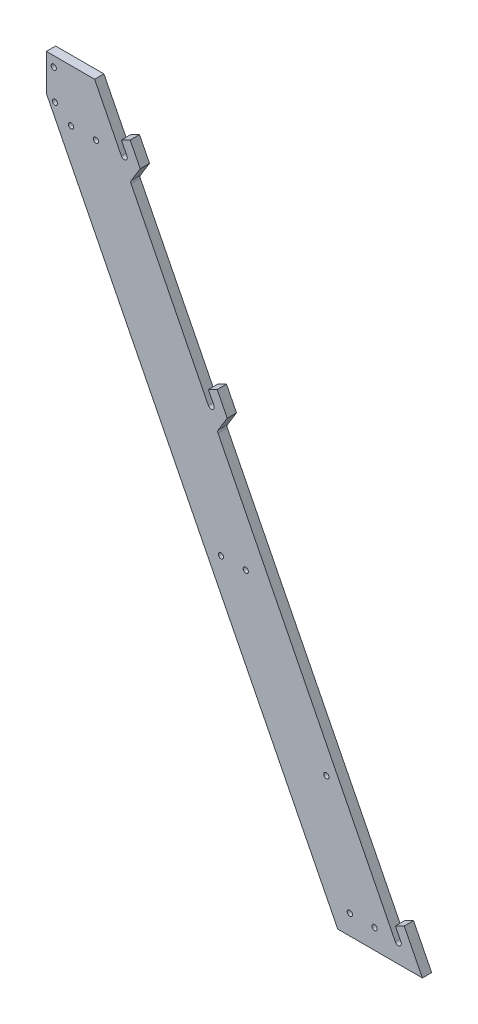
from build123d import *

# Parameters (mm, degrees)
BOSS_EXTRUDE1_DEPTH     = 5.953125
SKETCH3_W               = 47.23204247
SKETCH3_H               = 13.081
CUT_EXTRUDE1_DEPTH      = 924.398153884
BOSS_EXTRUDE3_DEPTH     = 11.90625
F_1_4_CLEARANCE_HOLE1_D = 6.7564
SKETCH13_W              = 23.41954247
SKETCH13_H              = 28.3464
CUT_EXTRUDE2_DEPTH      = 924.398153884
SKETCH14_R              = 3.429
CUT_EXTRUDE3_DEPTH      = 913.667776704
F_1_4_CLEARANCE_HOLE2_D = 6.7564
CUT_EXTRUDE4_DEPTH      = 913.667776704
BOSS_EXTRUDE4_START     = -11.90625
BOSS_EXTRUDE4_DEPTH     = 11.90625
BOSS_EXTRUDE5_DEPTH     = 11.90625
CUT_EXTRUDE5_DEPTH      = 912.387123535
FILLET1_R               = 3.3782


with BuildPart() as part:
    # Sketch1 → Boss-Extrude1 (new, symmetric)
    with BuildSketch(Plane.XY):
        Polygon((0, 0), (-396.875, 787.4), (-482.20704247, 787.4), (-85.33204247, 0), align=None)
    extrude(amount=BOSS_EXTRUDE1_DEPTH, both=True)

    # Sketch3 → Cut-Extrude1 (cut, through all)
    with BuildSketch(Plane.XY.offset(5.953125)):
        with Locations((-252.216021235, 371.4115)):
            Rectangle(SKETCH3_W, SKETCH3_H)
        with Locations((-444.303521235, 752.5131)):
            Rectangle(SKETCH3_W, SKETCH3_H)
    extrude(amount=-CUT_EXTRUDE1_DEPTH, mode=Mode.SUBTRACT)

    # Sketch10 → Boss-Extrude3 (add)
    with BuildSketch(Plane.XY.offset(5.953125)):
        with BuildLine():
            Line((-244.024703128, 501.780299783), (-249.740869802, 513.121174464))
            ThreePointArc((-249.740869802, 513.121174464), (-246.928515798, 521.649695143), (-238.39999512, 518.837341139))
            Line((-238.39999512, 518.837341139), (-226.967661771, 496.155591775))
            Line((-226.967661771, 496.155591775), (-239.680416455, 475.525946247))
            Line((-239.680416455, 475.525946247), (-251.112749804, 498.207695611))
            ThreePointArc((-251.112749804, 498.207695611), (-245.78242438, 496.449974359), (-244.024703128, 501.780299783))
        make_face()
        with BuildLine():
            Line((-351.145666605, 696.673002545), (-362.577999954, 719.354751908))
            ThreePointArc((-362.577999954, 719.354751908), (-357.24767453, 717.597030656), (-355.489953278, 722.92735608))
            Line((-355.489953278, 722.92735608), (-361.206119952, 734.268230762))
            ThreePointArc((-361.206119952, 734.268230762), (-358.393765948, 742.79675144), (-349.86524527, 739.984397436))
            Line((-349.86524527, 739.984397436), (-338.432911921, 717.302648072))
            Line((-338.432911921, 717.302648072), (-351.145666605, 696.673002545))
        make_face()
        with BuildLine():
            Line((0, 0), (-11.432333349, 22.681749364))
            ThreePointArc((-11.432333349, 22.681749364), (-6.102007925, 20.924028111), (-4.344286673, 26.254353535))
            Line((-4.344286673, 26.254353535), (-10.060453347, 37.595228217))
            ThreePointArc((-10.060453347, 37.595228217), (-7.248099343, 46.123748895), (1.280421335, 43.311394892))
            Line((1.280421335, 43.311394892), (12.712754684, 20.629645528))
            Line((12.712754684, 20.629645528), (23.110761502, 0))
            Line((23.110761502, 0), (0, 0))
        make_face()
    extrude(amount=-BOSS_EXTRUDE3_DEPTH)

    # 1/4 Clearance Hole1 (through all)
    with Locations(Plane.XY.offset(5.953125)):
        with Locations((-99.918593468, 162.967911886), (-427.0375, 720.5726), (-395.2875, 720.5726), (-203.2, 339.471), (-234.95, 339.471), (-69.85, 25.4), (-38.1, 25.4)):
            Hole(F_1_4_CLEARANCE_HOLE1_D / 2)

    # Sketch13 → Cut-Extrude2 (cut, through all)
    with BuildSketch(Plane.XY.offset(5.953125)):
        with Locations((-470.497271235, 773.2268)):
            Rectangle(SKETCH13_W, SKETCH13_H)
    extrude(amount=-CUT_EXTRUDE2_DEPTH, mode=Mode.SUBTRACT)

    # Sketch14 → Cut-Extrude3 (cut, through all)
    with BuildSketch(Plane.XY.offset(5.953125)):
        with Locations((-424.1165, 759.0536)):
            Circle(SKETCH14_R)
        with Locations((-424.1165, 745.9726)):
            Circle(SKETCH14_R)
        with Locations((-232.029, 377.952)):
            Circle(SKETCH14_R)
        with Locations((-232.029, 364.871)):
            Circle(SKETCH14_R)
    extrude(amount=-CUT_EXTRUDE3_DEPTH, mode=Mode.SUBTRACT)

    # 1/4 Clearance Hole2 (through all)
    with Locations(Plane.XY.offset(5.953125)):
        with Locations((-447.675, 736.6), (-449.2625, 774.7)):
            Hole(F_1_4_CLEARANCE_HOLE2_D / 2)

    # Sketch18 → Cut-Extrude4 (cut, through all)
    with BuildSketch(Plane.XY.offset(5.953125)):
        Polygon((-458.7875, 745.9726), (-458.7875, 740.93562774), (-461.326296502, 745.9726), align=None)
    extrude(amount=-CUT_EXTRUDE4_DEPTH, mode=Mode.SUBTRACT)

    # Sketch19 → Boss-Extrude4 (add)
    with BuildSketch(Plane(origin=(0, 0, -5.953125), x_dir=(-1, 0, 0), z_dir=(0, 0, -1)).offset(BOSS_EXTRUDE4_START)):
        with BuildLine():
            Line((458.7875, 759.0536), (458.7875, 745.9726))
            Line((458.7875, 745.9726), (427.5455, 745.9726))
            ThreePointArc((427.5455, 745.9726), (424.1165, 742.5436), (420.6875, 745.9726))
            Line((420.6875, 745.9726), (420.6875, 759.0536))
            ThreePointArc((420.6875, 759.0536), (424.1165, 762.4826), (427.5455, 759.0536))
            Line((427.5455, 759.0536), (458.7875, 759.0536))
        make_face()
        with BuildLine():
            Line((269.238796502, 364.871), (275.83204247, 377.952))
            Line((275.83204247, 377.952), (235.458, 377.952))
            ThreePointArc((235.458, 377.952), (232.029, 381.381), (228.6, 377.952))
            Line((228.6, 377.952), (228.6, 364.871))
            ThreePointArc((228.6, 364.871), (232.029, 361.442), (235.458, 364.871))
            Line((235.458, 364.871), (269.238796502, 364.871))
        make_face()
    extrude(amount=BOSS_EXTRUDE4_DEPTH)

    # Sketch20 → Boss-Extrude5 (add)
    with BuildSketch(Plane(origin=(0, 0, -5.953125), x_dir=(-1, 0, 0), z_dir=(0, 0, -1))):
        Polygon((349.86524527, 739.984397436), (361.206119952, 734.268230762), (364.064203289, 739.938668103), (352.723328607, 745.654834777), align=None)
        Polygon((238.39999512, 518.837341139), (249.740869802, 513.121174464), (252.598953139, 518.791611805), (241.258078457, 524.50777848), align=None)
        Polygon((-1.280421335, 43.311394892), (10.060453347, 37.595228217), (12.918536684, 43.265665558), (1.577662002, 48.981832233), align=None)
    extrude(amount=-BOSS_EXTRUDE5_DEPTH)

    # Sketch21 → Cut-Extrude5 (cut, through all)
    with BuildSketch(Plane(origin=(0, 0, -5.953125), x_dir=(-1, 0, 0), z_dir=(0, 0, -1))):
        Polygon((352.723328607, 745.654834777), (364.064203289, 739.938668103), (362.635161621, 737.103449432), (351.294286939, 742.819616107), align=None)
        Polygon((241.258078457, 524.50777848), (252.598953139, 518.791611805), (251.169911471, 515.956393135), (239.829036789, 521.672559809), align=None)
        Polygon((1.577662002, 48.981832233), (12.918536684, 43.265665558), (11.489495015, 40.430446888), (0.148620334, 46.146613562), align=None)
    extrude(amount=-CUT_EXTRUDE5_DEPTH, mode=Mode.SUBTRACT)

    # Fillet1
    fillet1_edges = [part.edges().sort_by_distance(p)[0] for p in [
        (-239.680416455, 475.525946247, 0),
        (-351.145666605, 696.673002545, 0),
    ]]
    fillet(fillet1_edges, radius=FILLET1_R)


solid = part.part
